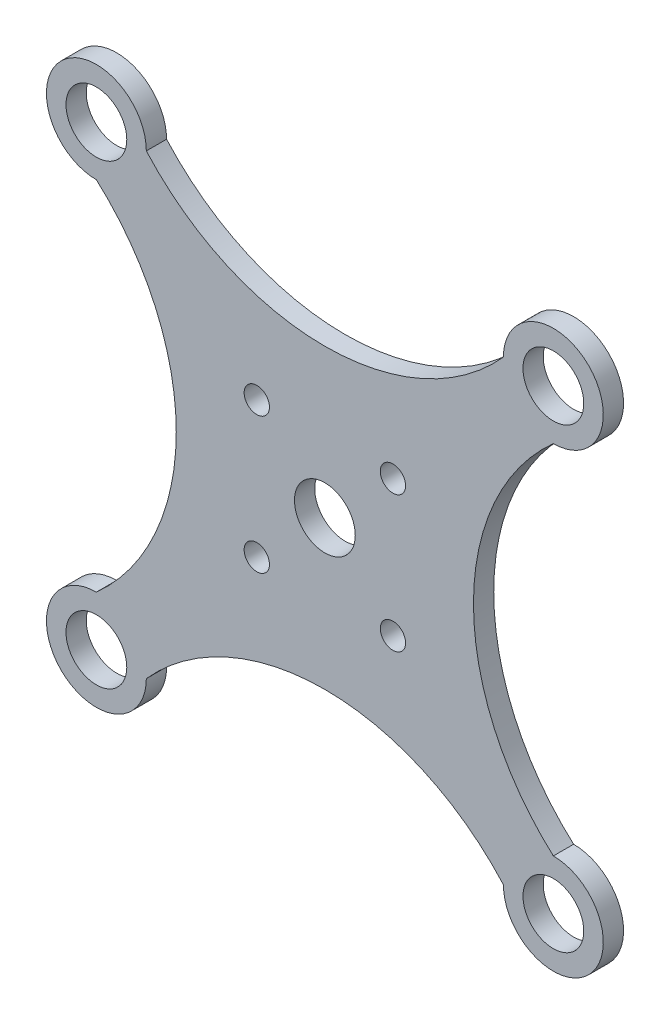
from build123d import *

# Parameters (mm, degrees)
CROQUIS1_W              = 55
CROQUIS1_H              = 55
CROQUIS1_R              = 3
CROQUIS1_R_2            = 1.25
SALIENTE_EXTRUIR1_DEPTH = 2
REDONDEO1_R             = 5
CORTAR_EXTRUIR1_DEPTH   = 2


with BuildPart() as part:
    # Croquis1 → Saliente-Extruir1 (new body)
    with BuildSketch(Plane.XY):
        Rectangle(CROQUIS1_W, CROQUIS1_H)
        with Locations((-22.550252532, 22.550252532)):
            Circle(CROQUIS1_R, mode=Mode.SUBTRACT)
        with Locations((22.550252532, 22.550252532)):
            Circle(CROQUIS1_R, mode=Mode.SUBTRACT)
        with Locations((22.550252532, -22.550252532)):
            Circle(CROQUIS1_R, mode=Mode.SUBTRACT)
        with Locations((-22.550252532, -22.550252532)):
            Circle(CROQUIS1_R, mode=Mode.SUBTRACT)
        Circle(CROQUIS1_R, mode=Mode.SUBTRACT)
        with Locations((-6.717514421, 6.717514421)):
            Circle(CROQUIS1_R_2, mode=Mode.SUBTRACT)
        with Locations((6.717514421, 6.717514421)):
            Circle(CROQUIS1_R_2, mode=Mode.SUBTRACT)
        with Locations((6.717514421, -6.717514421)):
            Circle(CROQUIS1_R_2, mode=Mode.SUBTRACT)
        with Locations((-6.717514421, -6.717514421)):
            Circle(CROQUIS1_R_2, mode=Mode.SUBTRACT)
    extrude(amount=SALIENTE_EXTRUIR1_DEPTH)

    # Redondeo1
    redondeo1_edges = [part.edges().sort_by_distance(p)[0] for p in [
        (27.5, -27.5, 1),
        (-27.5, -27.5, 1),
        (-27.5, 27.5, 1),
        (27.5, 27.5, 1),
    ]]
    fillet(redondeo1_edges, radius=REDONDEO1_R)

    # Croquis2 → Cortar-Extruir1 (cut)
    with BuildSketch(Plane.XY.offset(2)):
        with BuildLine():
            ThreePointArc((-26.035533906, -26.035533906), (-27.103992097, -20.664031844), (-22.550252532, -17.621320344))
            ThreePointArc((-22.550252532, -17.621320344), (-14.66565297, 0), (-22.550252532, 17.621320344))
            ThreePointArc((-22.550252532, 17.621320344), (-27.103991999, 20.664031606), (-26.03553427, 26.035533542))
            ThreePointArc((-26.03553427, 26.035533542), (-27.119397761, 24.413416924), (-27.5, 22.5))
            Line((-27.5, 22.5), (-27.5, -22.5))
            ThreePointArc((-27.5, -22.5), (-27.119397663, -24.413417162), (-26.035533906, -26.035533906))
        make_face()
        with BuildLine():
            ThreePointArc((-22.5, 27.5), (-24.4134174, 27.119397564), (-26.03553427, 26.035533542))
            ThreePointArc((-26.03553427, 26.035533542), (-20.664032082, 27.103992196), (-17.621320344, 22.550252532))
            ThreePointArc((-17.621320344, 22.550252532), (0, 14.66565297), (17.621320344, 22.550252532))
            ThreePointArc((17.621320344, 22.550252532), (20.664031651, 27.103992018), (26.035533611, 26.035534201))
            ThreePointArc((26.035533611, 26.035534201), (24.413416969, 27.119397742), (22.5, 27.5))
            Line((22.5, 27.5), (-22.5, 27.5))
        make_face()
        with BuildLine():
            ThreePointArc((22.550252532, -17.621320344), (27.10399228, -20.664032285), (26.03553323, -26.035534581))
            ThreePointArc((26.03553323, -26.035534581), (27.11939748, -24.413417603), (27.5, -22.5))
            Line((27.5, -22.5), (27.5, 22.5))
            ThreePointArc((27.5, 22.5), (27.119397583, 24.413417354), (26.035533611, 26.035534201))
            ThreePointArc((26.035533611, 26.035534201), (27.103992177, 20.664032037), (22.550252532, 17.621320344))
            ThreePointArc((22.550252532, 17.621320344), (14.66565297, 0), (22.550252532, -17.621320344))
        make_face()
        with BuildLine():
            ThreePointArc((-17.621320344, -22.550252532), (-20.664031844, -27.103992097), (-26.035533906, -26.035533906))
            ThreePointArc((-26.035533906, -26.035533906), (-24.413417162, -27.119397663), (-22.5, -27.5))
            Line((-22.5, -27.5), (22.5, -27.5))
            ThreePointArc((22.5, -27.5), (24.413416721, -27.119397845), (26.03553323, -26.035534581))
            ThreePointArc((26.03553323, -26.035534581), (20.664031403, -27.103991915), (17.621320344, -22.550252532))
            ThreePointArc((17.621320344, -22.550252532), (0, -14.66565297), (-17.621320344, -22.550252532))
        make_face()
    extrude(amount=-CORTAR_EXTRUIR1_DEPTH, mode=Mode.SUBTRACT)


solid = part.part
